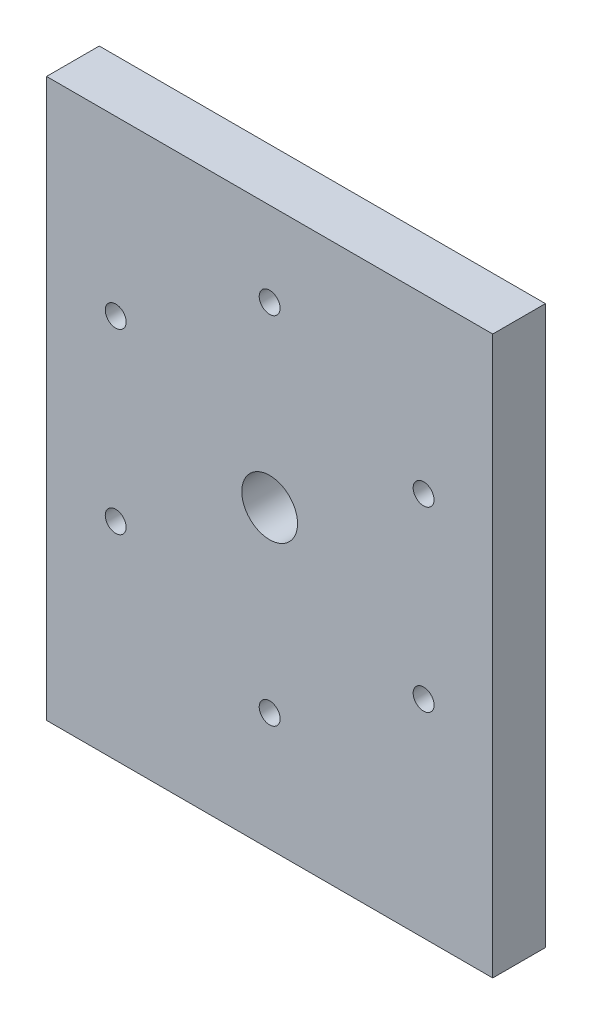
from build123d import *

# Parameters (mm, degrees)
SKETCH1_W           = 101.6
SKETCH1_H           = 127
SKETCH1_R           = 6.35
BOSS_EXTRUDE1_DEPTH = 12.0000014
SKETCH2_R           = 2.38125
CUT_EXTRUDE1_DEPTH  = 138.308557758
CIRPATTERN1_COUNT   = 6
SKETCH3_R           = 2.38125
CUT_EXTRUDE2_DEPTH  = 12.7


with BuildPart() as part:
    # Sketch1 → Boss-Extrude1 (new body)
    with BuildSketch(Plane.XY):
        with Locations((0, 63.5)):
            Rectangle(SKETCH1_W, SKETCH1_H)
        with Locations((0, 67.3749986)):
            Circle(SKETCH1_R, mode=Mode.SUBTRACT)
    extrude(amount=BOSS_EXTRUDE1_DEPTH)

    # Sketch2 → Cut-Extrude1 (cut, through all)
    with BuildSketch(Plane(origin=(0, 0, 0), x_dir=(-1, 0, 0), z_dir=(0, 0, -1))):
        with Locations((0, 107.8562486)):
            Circle(SKETCH2_R)
    cut_extrude1 = extrude(amount=-CUT_EXTRUDE1_DEPTH, mode=Mode.SUBTRACT)

    # CirPattern1: Cut-Extrude1 ×6 about axis
    cirpattern1_axis = Axis((0, 67.3749986, 0), (0, 0, 1))
    for i in range(1, CIRPATTERN1_COUNT):
        add(cut_extrude1.rotate(cirpattern1_axis, i * 360 / CIRPATTERN1_COUNT), mode=Mode.SUBTRACT)

    # Sketch3 → Cut-Extrude2 (cut)
    with BuildSketch(Plane.XZ):
        with Locations(Location((31.75, 6.0000007, 0), (0, 0, 270))):
            Circle(SKETCH3_R)
        with Locations(Location((0, 6.0000007, 0), (0, 0, 270))):
            Circle(SKETCH3_R)
        with Locations(Location((-31.75, 6.0000007, 0), (0, 0, 270))):
            Circle(SKETCH3_R)
    extrude(amount=-CUT_EXTRUDE2_DEPTH, mode=Mode.SUBTRACT)


solid = part.part
